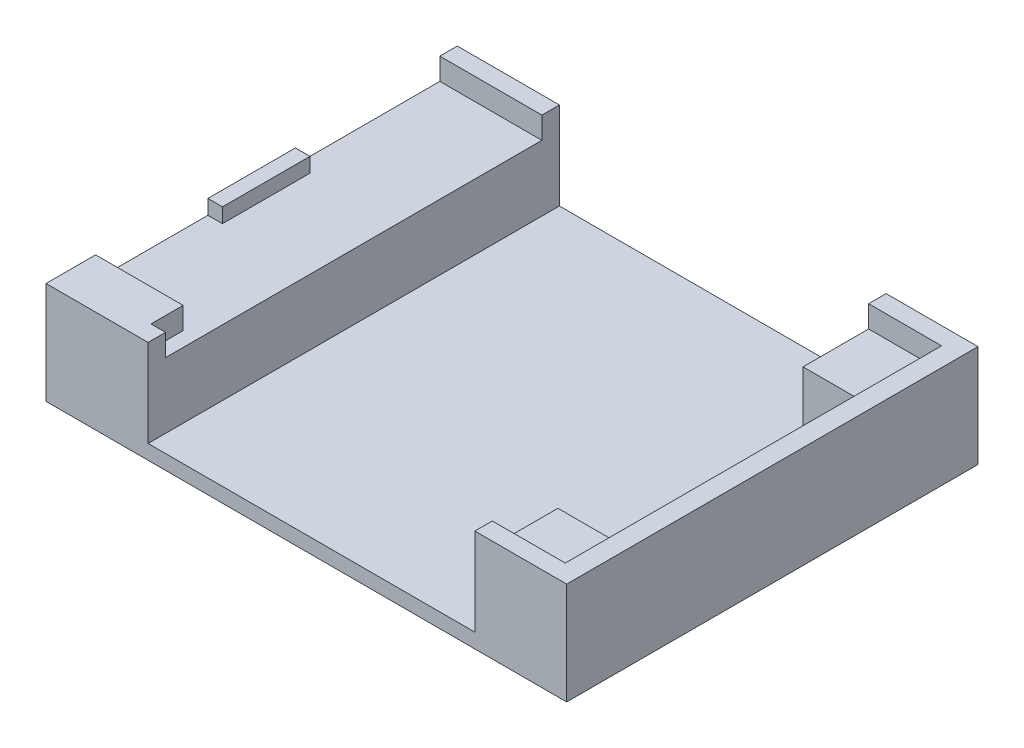
from build123d import *

# Parameters (mm, degrees)
SKETCH1_W           = 35.7
SKETCH1_H           = 28.2
BOSS_EXTRUDE1_DEPTH = 7
SKETCH2_W           = 34.4
SKETCH2_H           = 25.8
CUT_EXTRUDE1_DEPTH  = 1.5
CUT_EXTRUDE2_DEPTH  = 4.5
SKETCH4_W           = 22.4
SKETCH4_H           = 1.2
CUT_EXTRUDE3_DEPTH  = 6
SKETCH5_W           = 1
SKETCH5_H           = 6
BOSS_EXTRUDE2_DEPTH = 1
SKETCH6_W           = 6
SKETCH6_H           = 2.2
BOSS_EXTRUDE3_DEPTH = 1.5


with BuildPart() as part:
    # Sketch1 → Boss-Extrude1 (new body)
    with BuildSketch(Plane(origin=(0, 0, 0), x_dir=(1, 0, 0), z_dir=(0, 1, 0))):
        Rectangle(SKETCH1_W, SKETCH1_H)
    extrude(amount=BOSS_EXTRUDE1_DEPTH)

    # Sketch2 → Cut-Extrude1 (cut)
    with BuildSketch(Plane(origin=(0, 7, 0), x_dir=(1, 0, 0), z_dir=(0, 1, 0))):
        with Locations((-0.65, 0)):
            Rectangle(SKETCH2_W, SKETCH2_H)
    extrude(amount=-CUT_EXTRUDE1_DEPTH, mode=Mode.SUBTRACT)

    # Sketch3 → Cut-Extrude2 (cut)
    with BuildSketch(Plane(origin=(0, 5.5, 0), x_dir=(1, 0, 0), z_dir=(0, 1, 0))):
        Polygon((-10.85, 12.9), (-10.85, -12.9), (11.55, -12.9), (11.55, -8.4), (16.55, -8.4), (16.55, 8.4), (11.55, 8.4), (11.55, 12.9), align=None)
    extrude(amount=-CUT_EXTRUDE2_DEPTH, mode=Mode.SUBTRACT)

    # Sketch4 → Cut-Extrude3 (cut)
    with BuildSketch(Plane(origin=(0, 7, 0), x_dir=(1, 0, 0), z_dir=(0, 1, 0))):
        with Locations((0.35, -13.5)):
            Rectangle(SKETCH4_W, SKETCH4_H)
    cut_extrude3 = extrude(amount=-CUT_EXTRUDE3_DEPTH, mode=Mode.SUBTRACT)

    # Mirror1: Cut-Extrude3 across plane
    add(cut_extrude3.mirror(Plane.XY), mode=Mode.SUBTRACT)

    # Sketch5 → Boss-Extrude2 (add)
    with BuildSketch(Plane(origin=(0, 5.5, 0), x_dir=(1, 0, 0), z_dir=(0, 1, 0))):
        with Locations((-17.35, 0)):
            Rectangle(SKETCH5_W, SKETCH5_H)
    extrude(amount=BOSS_EXTRUDE2_DEPTH)

    # Sketch6 → Boss-Extrude3 (add)
    with BuildSketch(Plane(origin=(0, 5.5, 0), x_dir=(1, 0, 0), z_dir=(0, 1, 0))):
        with Locations((-14.85, -11.8)):
            Rectangle(SKETCH6_W, SKETCH6_H)
    extrude(amount=BOSS_EXTRUDE3_DEPTH)


solid = part.part
